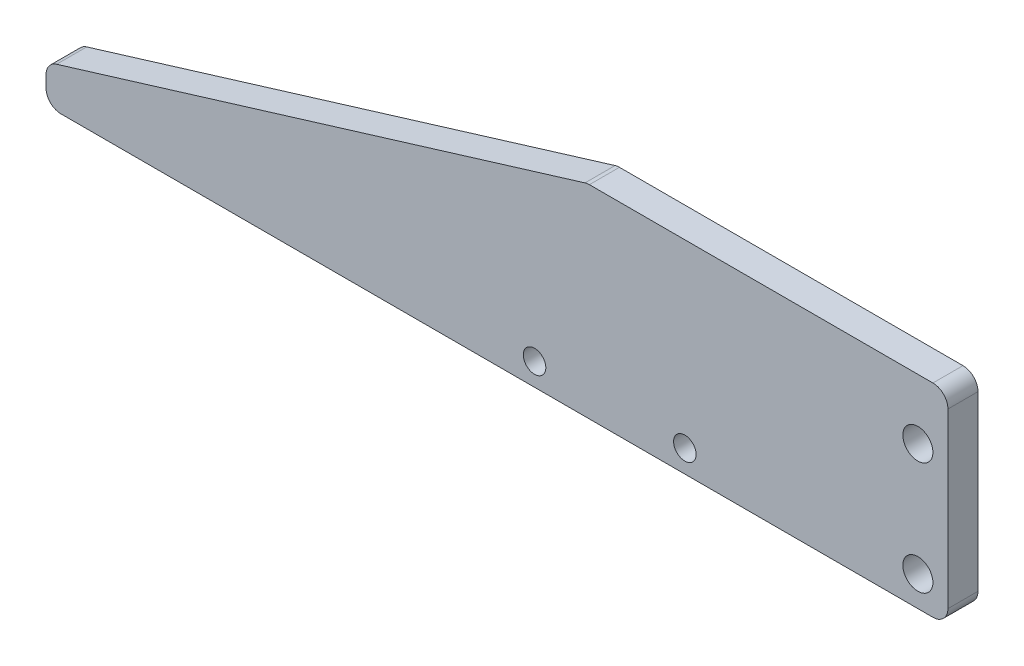
from build123d import *

# Parameters (mm, degrees)
SKETCH_1_W          = 120
SKETCH_1_H          = 27
SKETCH_1_R          = 2
SKETCH_1_R_2        = 1.5
EXTRUDE_1_DEPTH     = 4
CUT_EXTRUDE_1_DEPTH = 10
FILLET_1_R          = 2


with BuildPart() as part:
    # 草图1 → 凸台-拉伸1 (new body)
    with BuildSketch(Plane.XY):
        Rectangle(SKETCH_1_W, SKETCH_1_H)
        with Locations((56, 5.5)):
            Circle(SKETCH_1_R, mode=Mode.SUBTRACT)
        with Locations((56, -9.5)):
            Circle(SKETCH_1_R, mode=Mode.SUBTRACT)
        with Locations((25, -10.5)):
            Circle(SKETCH_1_R_2, mode=Mode.SUBTRACT)
        with Locations((5, -10.5)):
            Circle(SKETCH_1_R_2, mode=Mode.SUBTRACT)
    extrude(amount=EXTRUDE_1_DEPTH)

    # 草图2 → 切除-拉伸1 (cut)
    with BuildSketch(Plane(origin=(0, 0, 0), x_dir=(-1, 0, 0), z_dir=(0, 0, -1))):
        Polygon((60, -8.5), (-12, 13.5), (60, 13.5), align=None)
    extrude(amount=-CUT_EXTRUDE_1_DEPTH, mode=Mode.SUBTRACT)

    # 圆角1
    fillet_1_edges = [part.edges().sort_by_distance(p)[0] for p in [
        (-60, -8.5, 2),
        (12, 13.5, 2),
        (60, -13.5, 2),
        (-60, -13.5, 2),
        (60, 13.5, 2),
    ]]
    fillet(fillet_1_edges, radius=FILLET_1_R)


solid = part.part
